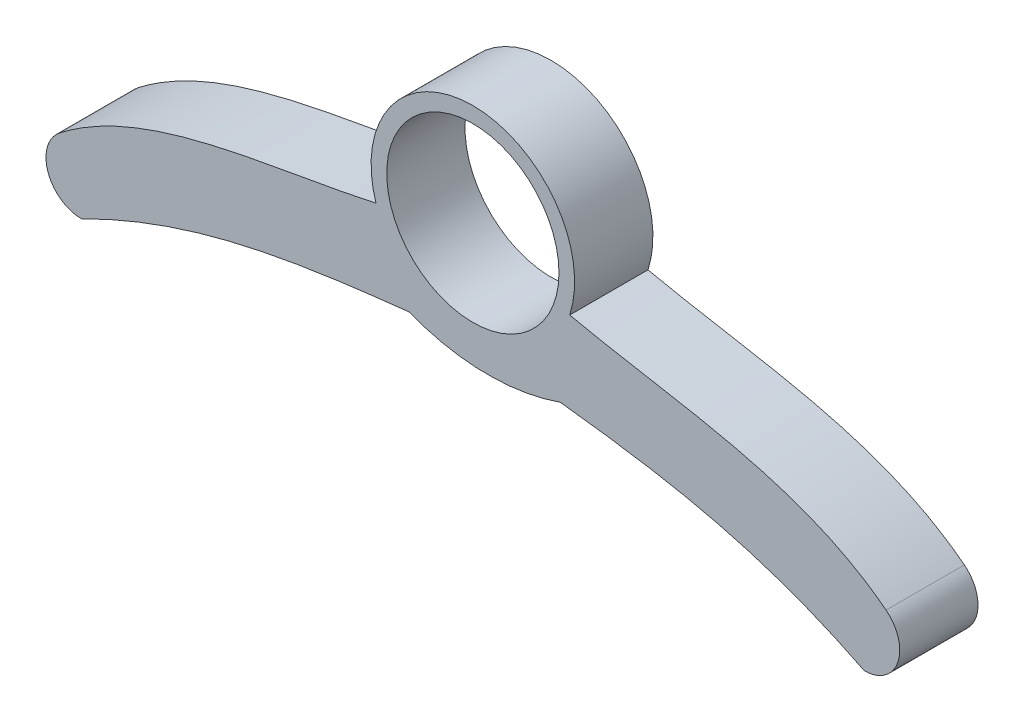
from build123d import *

# Parameters (mm, degrees)
SKETCH1_R           = 11
BOSS_EXTRUDE2_DEPTH = 10


with BuildPart() as part:
    # Sketch1 → Boss-Extrude2 (new body)
    with BuildSketch(Plane.XY):
        with BuildLine():
            ThreePointArc((12.372116541, -3.991332145), (0, 13), (-12.372116541, -3.991332145))
            add(Edge.make_bspline(
                [(-12.372116541, -3.991332145), (-26.033828429, -7.02831389), (-41.667558827, -7.769082655), (-52.782972627, -16.427166435)],
                knots=[0.243651576, 0.243651576, 0.243651576, 0.243651576, 1, 1, 1, 1], degree=3))
            ThreePointArc((-52.782972627, -16.427166435), (-54.283149744, -21.471293509), (-50, -24.528805176))
            add(Edge.make_bspline(
                [(-50, -24.528805176), (-35.643842749, -17.302233424), (-22.951681631, -15.556213893), (-8.168986124, -13.907692957)],
                knots=[0, 0, 0, 0, 0.848050859, 0.848050859, 0.848050859, 0.848050859], degree=3))
            ThreePointArc((-8.168986124, -13.907692957), (1.464652086, -15.812122585), (11.159249547, -14.247316707))
            add(Edge.make_bspline(
                [(11.159249547, -14.247316707), (24.686928923, -15.819249429), (36.620856901, -17.79404072), (50, -24.528805176)],
                knots=[1, 1, 1, 1, 1.790336411, 1.790336411, 1.790336411, 1.790336411], degree=3))
            ThreePointArc((50, -24.528805176), (54.283149744, -21.471293509), (52.782972627, -16.427166435))
            add(Edge.make_bspline(
                [(12.372116541, -3.991332145), (26.033828429, -7.02831389), (41.667558827, -7.769082655), (52.782972627, -16.427166435)],
                knots=[0.243651576, 0.243651576, 0.243651576, 0.243651576, 1, 1, 1, 1], degree=3))
        make_face()
        Circle(SKETCH1_R, mode=Mode.SUBTRACT)
    extrude(amount=BOSS_EXTRUDE2_DEPTH)


solid = part.part
